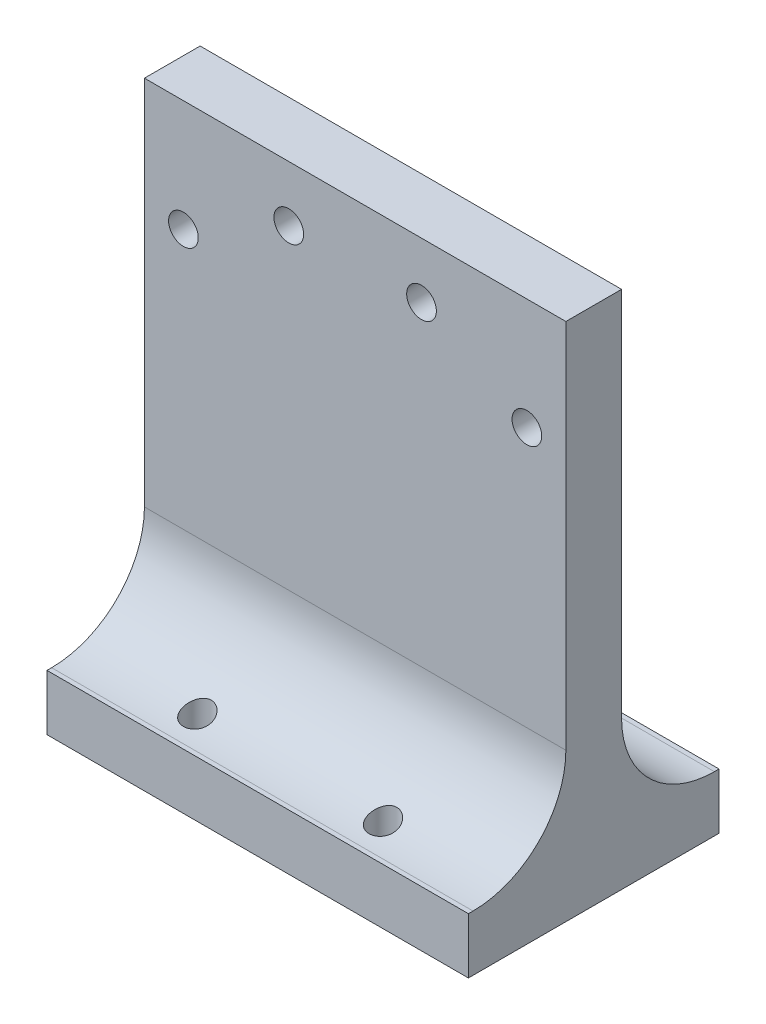
from build123d import *

# Parameters (mm, degrees)
SKETCH1_W             = 45.4
SKETCH1_H             = 27
BOSS_EXTRUDE1_DEPTH   = 6
SKETCH4_W             = 45.4
SKETCH4_H             = 6
BOSS_EXTRUDE2_DEPTH   = 50
FILLET3_R             = 10
F_3_0MM_DOWEL_HOLE1_D = 3
F_3_0MM_DOWEL_HOLE2_D = 3.2
F_3_0MM_DOWEL_HOLE3_D = 3.2


with BuildPart() as part:
    # Sketch1 → Boss-Extrude1 (new body)
    with BuildSketch(Plane(origin=(0, 0, 0), x_dir=(1, 0, 0), z_dir=(0, 1, 0))):
        with Locations((22.7, 13.5)):
            Rectangle(SKETCH1_W, SKETCH1_H)
    extrude(amount=BOSS_EXTRUDE1_DEPTH)

    # Sketch4 → Boss-Extrude2 (add)
    with BuildSketch(Plane(origin=(0, 6, 0), x_dir=(1, 0, 0), z_dir=(0, 1, 0))):
        with Locations((22.7, 13.5)):
            Rectangle(SKETCH4_W, SKETCH4_H)
    extrude(amount=BOSS_EXTRUDE2_DEPTH)

    # Fillet3
    fillet3_edges = [part.edges().sort_by_distance(p)[0] for p in [
        (22.7, 6, -10.5),
        (22.7, 6, -16.5),
    ]]
    fillet(fillet3_edges, radius=FILLET3_R)

    # Ø3.0mm Dowel Hole1 (through all)
    with Locations(Plane(origin=(0, 16, 0), x_dir=(1, 0, 0), z_dir=(0, 1, 0))):
        with Locations((12.7, 23.5), (32.7, 23.5), (32.7, 3.5), (12.7, 3.5)):
            Hole(F_3_0MM_DOWEL_HOLE1_D / 2)

    # Ø3.0mm Dowel Hole2 (through all)
    with Locations(Plane(origin=(0, 0, -16.5), x_dir=(-1, 0, 0), z_dir=(0, 0, -1))):
        with Locations((-29.85, 50), (-15.55, 50)):
            Hole(F_3_0MM_DOWEL_HOLE2_D / 2)

    # Ø3.0mm Dowel Hole3 (through all)
    with Locations(Plane(origin=(4.2, 44, -16.5), x_dir=(-1, 0, 0), z_dir=(0, 0, -1))):
        with Locations((0, 0), (-37, 0)):
            Hole(F_3_0MM_DOWEL_HOLE3_D / 2)


solid = part.part
